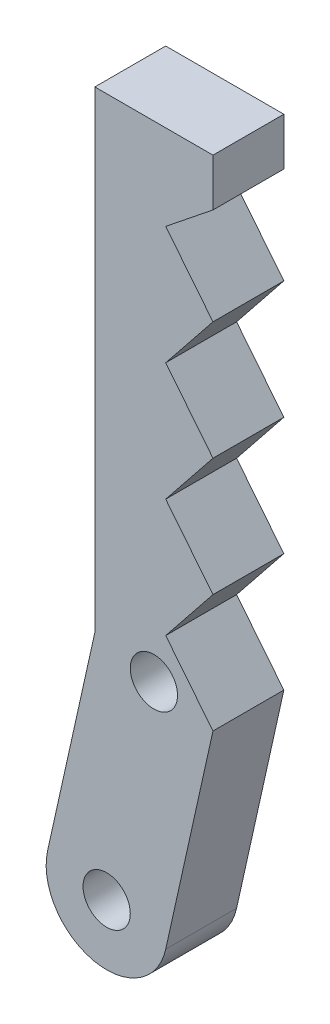
from build123d import *

# Parameters (mm, degrees)
SKETCH1_R           = 2
BOSS_EXTRUDE1_DEPTH = 6


with BuildPart() as part:
    # Sketch1 → Boss-Extrude1 (new body)
    with BuildSketch(Plane.XY):
        with BuildLine():
            Line((-10, 40.127930694), (-10, 0.127930694))
            Line((-10, 0.127930694), (-14.000572229, -17.872875451))
            ThreePointArc((-14.000572229, -17.872875451), (-10.109933276, -23.981807176), (-4, -20.092741267))
            Line((-4, -20.092741267), (0, -2.0945099))
            Line((0, -2.0945099), (-4, 2.9054901))
            Line((-4, 2.9054901), (0, 7.9054901))
            Line((0, 7.9054901), (-4, 12.9054901))
            Line((-4, 12.9054901), (0, 17.9054901))
            Line((0, 17.9054901), (-4, 22.9054901))
            Line((-4, 22.9054901), (0, 27.9054901))
            Line((0, 27.9054901), (-4, 32.9054901))
            Line((-4, 32.9054901), (0, 36.1054901))
            Line((0, 36.1054901), (0, 40.127930694))
            Line((0, 40.127930694), (-10, 40.127930694))
        make_face()
        with Locations((-5, -0.983289603)):
            Circle(SKETCH1_R, mode=Mode.SUBTRACT)
        with Locations((-9.000000331, -18.981520896)):
            Circle(SKETCH1_R, mode=Mode.SUBTRACT)
    extrude(amount=BOSS_EXTRUDE1_DEPTH)


solid = part.part
